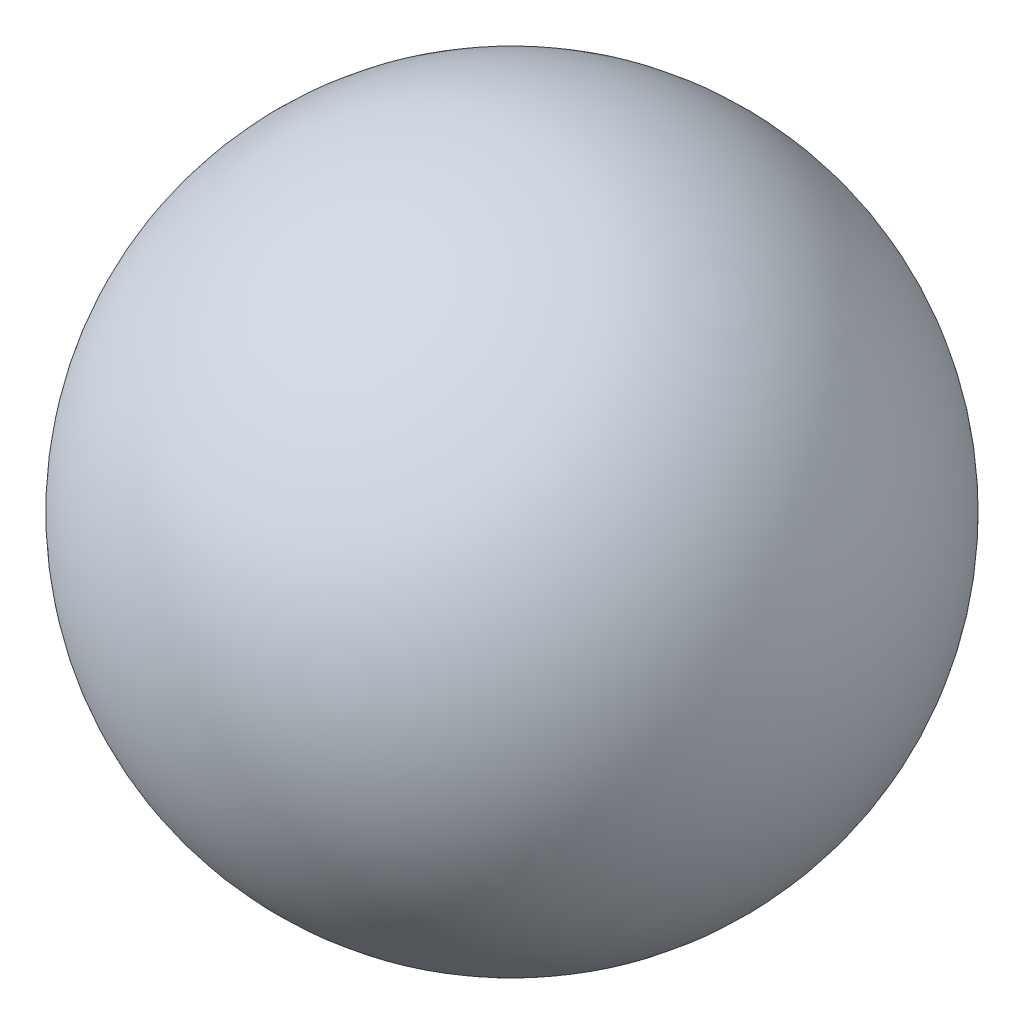
from build123d import *


with BuildPart() as part:
    # Sketch2 → Revolve1 (revolve)
    with BuildSketch(Plane.XY):
        with BuildLine():
            ThreePointArc((-18.5, 0), (-13.081475452, -13.081475452), (0, -18.5))
            Line((0, -18.5), (0, 0))
            Line((0, 0), (-18.5, 0))
        make_face()
        with BuildLine():
            Line((-18.5, 0), (0, 0))
            Line((0, 0), (0, 18.5))
            ThreePointArc((0, 18.5), (-13.081475452, 13.081475452), (-18.5, 0))
        make_face()
    revolve(axis=Axis((0, -18.5, 0), (0, 1, 0)))


solid = part.part
